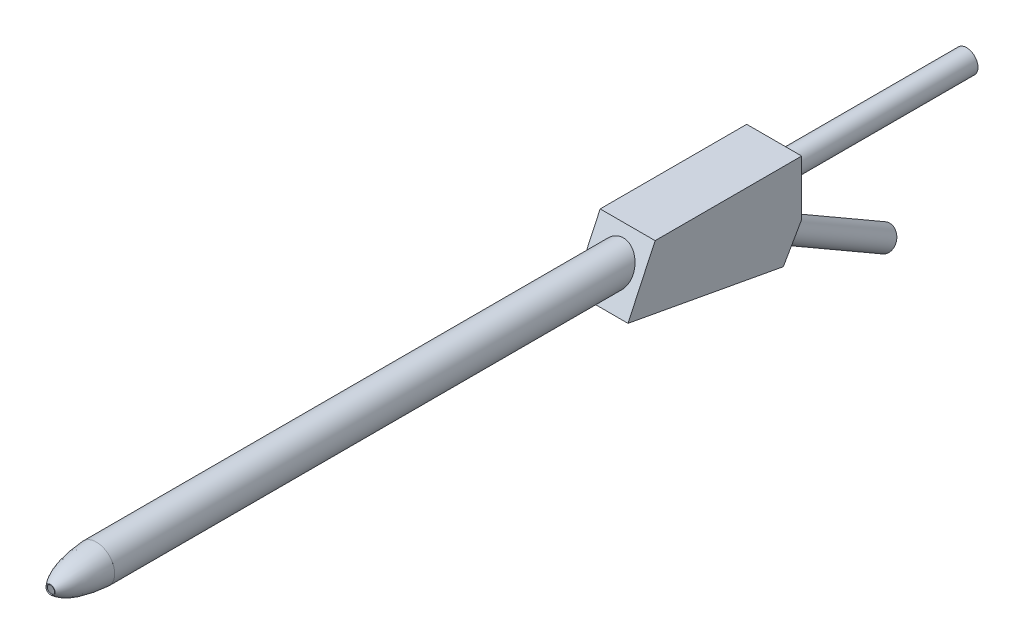
from build123d import *

# Parameters (mm, degrees)
BOSS_EXTRUDE1_DEPTH = 6
SKETCH3_R           = 2
SKETCH3_R_2         = 1.9
BOSS_EXTRUDE2_DEPTH = 58
SKETCH3_3_R         = 1.25
SKETCH3_3_R_2       = 1.15
BOSS_EXTRUDE3_DEPTH = 37
SKETCH4_R           = 1.25
SKETCH4_R_2         = 1.15
BOSS_EXTRUDE4_DEPTH = 15


with BuildPart() as part:
    # Sketch2 → Boss-Extrude1 (new body)
    with BuildSketch(Plane(origin=(0, 0, 0), x_dir=(0, 0, -1), z_dir=(1, 0, 0))):
        Polygon((0, 0), (16, 0), (16, -6), (14, -9.464101615), (-2.961641111, -6.342608448), align=None)
    extrude(amount=BOSS_EXTRUDE1_DEPTH)

    # Sketch3 → Boss-Extrude2 (add)
    with BuildSketch(Plane.XY):
        with Locations((3, -3)):
            Circle(SKETCH3_R)
        with Locations((3, -3)):
            Circle(SKETCH3_R_2, mode=Mode.SUBTRACT)
    extrude(amount=BOSS_EXTRUDE2_DEPTH)

    # Sketch3<3> → Boss-Extrude3 (add)
    with BuildSketch(Plane.XY):
        with Locations((3, -3)):
            Circle(SKETCH3_3_R)
        with Locations((3, -3)):
            Circle(SKETCH3_3_R_2, mode=Mode.SUBTRACT)
    extrude(amount=-BOSS_EXTRUDE3_DEPTH)

    # Sketch4 → Boss-Extrude4 (add)
    with BuildSketch(Plane(origin=(0, -8.42820323, -14.598076211), x_dir=(-1, 0, 0), z_dir=(0, -0.500000000000001, -0.8660254037844382))):
        with Locations((-3, 0.803847577)):
            Circle(SKETCH4_R)
        with Locations((-3, 0.803847577)):
            Circle(SKETCH4_R_2, mode=Mode.SUBTRACT)
    extrude(amount=BOSS_EXTRUDE4_DEPTH)


with BuildPart() as body_2:
    # Sketch8 → Revolve1 (revolve)
    with BuildSketch(Plane(origin=(3, 0, 0), x_dir=(0, 0, -1), z_dir=(1, 0, 0))):
        with BuildLine():
            Line((-58, -1), (-57.994130513, -1.099827597))
            add(Edge.make_bspline(
                [(-57.994130513, -1.099827597), (-58.280311263, -1.116653948), (-58.867724332, -1.163704732), (-59.911727334, -1.299942949), (-61.0596021, -1.55463474), (-61.971470964, -1.916626175), (-62.568466051, -2.273453071), (-62.814295678, -2.466279549), (-62.93271753, -2.573980195)],
                knots=[0, 0, 0, 0, 0.125, 0.25, 0.5, 0.75, 0.875, 1, 1, 1, 1], degree=3))
            ThreePointArc((-62.93271753, -2.573980195), (-63.00123195, -2.568706073), (-63, -2.5))
            add(Edge.make_bspline(
                [(-58, -1), (-61.582271416, -1.21062408), (-63, -2.5)],
                knots=[0, 0, 0, 1, 1, 1], degree=2))
        make_face()
    revolve(axis=Axis((3, -3, 58), (0, 0, 1)))


solid = Compound([part.part, body_2.part])
